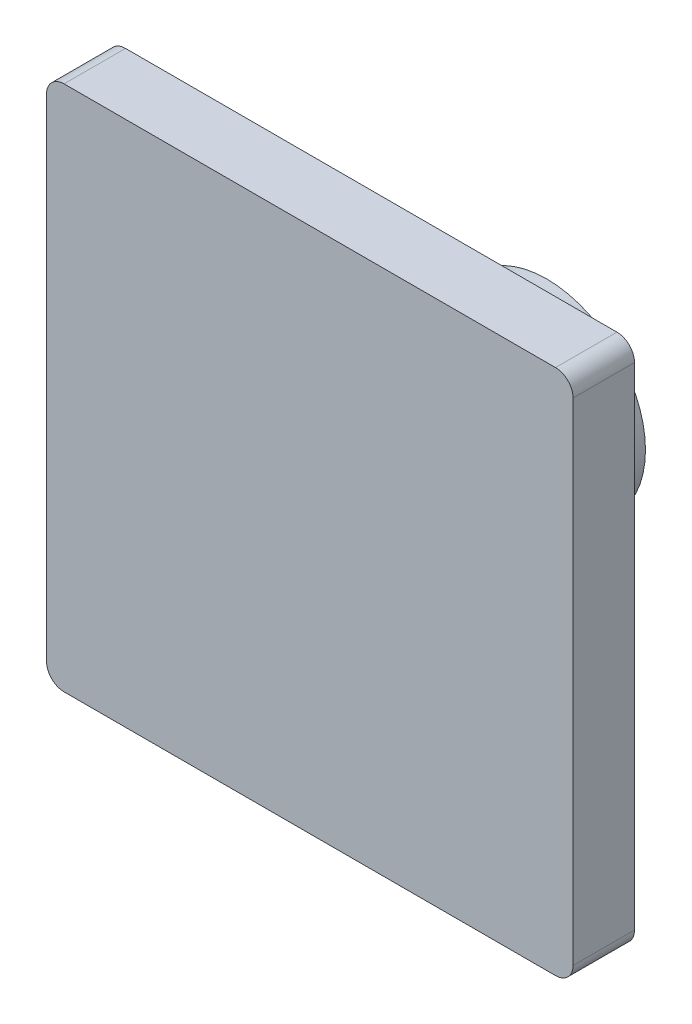
from build123d import *

# Parameters (mm, degrees)
ESQUISSE1_W          = 60
ESQUISSE1_H          = 60
BASE_EXTRUSION_DEPTH = 7
CONG_2_R             = 2
ESQUISSE14_R         = 11.25
BOSS_EXTRU_12_DEPTH  = 20


with BuildPart() as part:
    # Esquisse1 → Base-Extrusion (new body)
    with BuildSketch(Plane.XY):
        Rectangle(ESQUISSE1_W, ESQUISSE1_H)
    extrude(amount=BASE_EXTRUSION_DEPTH)

    # Congé2
    cong_2_edges = [part.edges().sort_by_distance(p)[0] for p in [
        (-30, 30, 3.5),
        (30, 30, 3.5),
        (30, -30, 3.5),
        (-30, -30, 3.5),
    ]]
    fillet(cong_2_edges, radius=CONG_2_R)

    # Esquisse14 → Boss.-Extru.12 (add)
    with BuildSketch(Plane(origin=(0, 0, 0), x_dir=(-1, 0, 0), z_dir=(0, 0, -1))):
        with Locations(Location((0, 0, 0), (0, 0, 180))):
            Circle(ESQUISSE14_R)
    extrude(amount=BOSS_EXTRU_12_DEPTH)


solid = part.part
